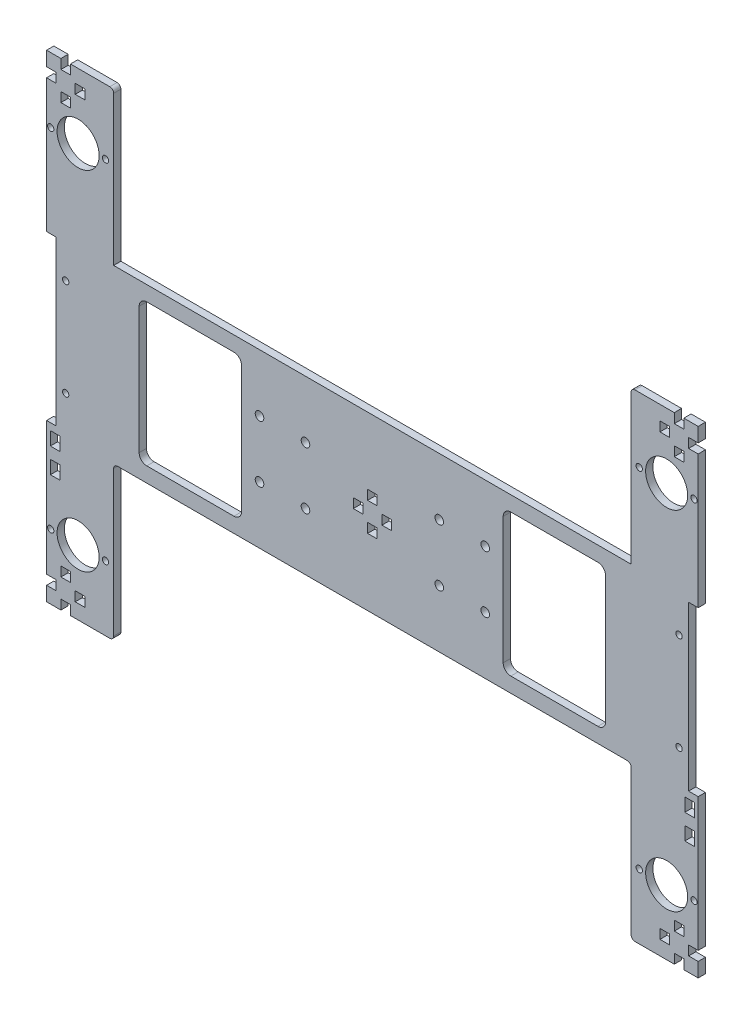
from build123d import *

# Parameters (mm, degrees)
SKETCH2_R           = 1.65
SKETCH2_R_2         = 11
SKETCH2_R_3         = 2.25
SKETCH2_W           = 5
SKETCH2_H           = 5
SKETCH2_H_2         = 7
BOSS_EXTRUDE1_DEPTH = 3.8


with BuildPart() as part:
    # Sketch2 → Boss-Extrude1 (new body)
    with BuildSketch(Plane.XY):
        with BuildLine():
            Line((-170.5, -100), (-163, -100))
            Line((-163, -100), (-163, -95))
            Line((-163, -95), (-158, -95))
            Line((-158, -95), (-158, -100))
            Line((-158, -100), (-137.4, -100))
            ThreePointArc((-137.4, -100), (-135.985786438, -99.414213562), (-135.4, -98))
            Line((-135.4, -98), (-135.4, -22))
            ThreePointArc((-135.4, -22), (-134.814213562, -20.585786438), (-133.4, -20))
            Line((-133.4, -20), (133.4, -20))
            ThreePointArc((133.4, -20), (134.814213562, -20.585786438), (135.4, -22))
            Line((135.4, -22), (135.4, -98))
            ThreePointArc((135.4, -98), (135.985786438, -99.414213562), (137.4, -100))
            Line((137.4, -100), (158, -100))
            Line((158, -100), (158, -95))
            Line((158, -95), (163, -95))
            Line((163, -95), (163, -100))
            Line((163, -100), (170.5, -100))
            Line((170.5, -100), (170.5, -92.5))
            Line((170.5, -92.5), (165.5, -92.5))
            Line((165.5, -92.5), (165.5, -87.5))
            Line((165.5, -87.5), (170.5, -87.5))
            Line((170.5, -87.5), (170.5, -17.8042249))
            Line((170.5, -17.8042249), (165.5, -17.8042249))
            Line((165.5, -17.8042249), (165.5, 67.8042249))
            Line((165.5, 67.8042249), (170.5, 67.8042249))
            Line((170.5, 67.8042249), (170.5, 137.5))
            Line((170.5, 137.5), (165.5, 137.5))
            Line((165.5, 137.5), (165.5, 142.5))
            Line((165.5, 142.5), (170.5, 142.5))
            Line((170.5, 142.5), (170.5, 150))
            Line((170.5, 150), (163, 150))
            Line((163, 150), (163, 145))
            Line((163, 145), (158, 145))
            Line((158, 145), (158, 150))
            Line((158, 150), (137.4, 150))
            ThreePointArc((137.4, 150), (135.985786438, 149.414213562), (135.4, 148))
            Line((135.4, 148), (135.4, 70))
            Line((135.4, 70), (-135.4, 70))
            Line((-135.4, 70), (-135.4, 148))
            ThreePointArc((-135.4, 148), (-135.985786438, 149.414213562), (-137.4, 150))
            Line((-137.4, 150), (-158, 150))
            Line((-158, 150), (-158, 145))
            Line((-158, 145), (-163, 145))
            Line((-163, 145), (-163, 150))
            Line((-163, 150), (-170.5, 150))
            Line((-170.5, 150), (-170.5, 142.5))
            Line((-170.5, 142.5), (-165.5, 142.5))
            Line((-165.5, 142.5), (-165.5, 137.5))
            Line((-165.5, 137.5), (-170.5, 137.5))
            Line((-170.5, 137.5), (-170.5, 67.8042249))
            Line((-170.5, 67.8042249), (-165.5, 67.8042249))
            Line((-165.5, 67.8042249), (-165.5, -17.8042249))
            Line((-165.5, -17.8042249), (-170.5, -17.8042249))
            Line((-170.5, -17.8042249), (-170.5, -87.5))
            Line((-170.5, -87.5), (-165.5, -87.5))
            Line((-165.5, -87.5), (-165.5, -92.5))
            Line((-165.5, -92.5), (-170.5, -92.5))
            Line((-170.5, -92.5), (-170.5, -100))
        make_face()
        with Locations(Location((-168.334802826, 116, 0), (0, 0, 180))):
            Circle(SKETCH2_R, mode=Mode.SUBTRACT)
        with Locations(Location((-139.665197174, 116, 0), (0, 0, 180))):
            Circle(SKETCH2_R, mode=Mode.SUBTRACT)
        with Locations(Location((168.334802826, 116, 0), (0, 0, 180))):
            Circle(SKETCH2_R, mode=Mode.SUBTRACT)
        with Locations(Location((139.665197174, 116, 0), (0, 0, 180))):
            Circle(SKETCH2_R, mode=Mode.SUBTRACT)
        with Locations(Location((154, 116, 0), (0, 0, 180))):
            Circle(SKETCH2_R_2, mode=Mode.SUBTRACT)
        with Locations(Location((-154, 116, 0), (0, 0, 180))):
            Circle(SKETCH2_R_2, mode=Mode.SUBTRACT)
        with Locations(Location((160.5, -0.5, 0), (0, 0, 180))):
            Circle(SKETCH2_R, mode=Mode.SUBTRACT)
        with Locations(Location((160.5, 50.5, 0), (0, 0, 180))):
            Circle(SKETCH2_R, mode=Mode.SUBTRACT)
        with Locations(Location((-160.5, -0.5, 0), (0, 0, 180))):
            Circle(SKETCH2_R, mode=Mode.SUBTRACT)
        with Locations(Location((-160.5, 50.5, 0), (0, 0, 180))):
            Circle(SKETCH2_R, mode=Mode.SUBTRACT)
        with Locations(Location((-35, 10.055, 0), (0, 0, 180))):
            Circle(SKETCH2_R_3, mode=Mode.SUBTRACT)
        with Locations(Location((-35, 39.945, 0), (0, 0, 180))):
            Circle(SKETCH2_R_3, mode=Mode.SUBTRACT)
        with Locations(Location((-59.06, 39.945, 0), (0, 0, 180))):
            Circle(SKETCH2_R_3, mode=Mode.SUBTRACT)
        with Locations(Location((-59.06, 10.055, 0), (0, 0, 180))):
            Circle(SKETCH2_R_3, mode=Mode.SUBTRACT)
        with Locations(Location((59.06, 10.055, 0), (0, 0, 180))):
            Circle(SKETCH2_R_3, mode=Mode.SUBTRACT)
        with Locations(Location((35, 10.055, 0), (0, 0, 180))):
            Circle(SKETCH2_R_3, mode=Mode.SUBTRACT)
        with Locations(Location((35, 39.945, 0), (0, 0, 180))):
            Circle(SKETCH2_R_3, mode=Mode.SUBTRACT)
        with Locations(Location((59.06, 39.945, 0), (0, 0, 180))):
            Circle(SKETCH2_R_3, mode=Mode.SUBTRACT)
        with Locations(Location((168.334802826, -66, 0), (0, 0, 180))):
            Circle(SKETCH2_R, mode=Mode.SUBTRACT)
        with Locations(Location((139.665197174, -66, 0), (0, 0, 180))):
            Circle(SKETCH2_R, mode=Mode.SUBTRACT)
        with Locations(Location((154, -66, 0), (0, 0, 180))):
            Circle(SKETCH2_R_2, mode=Mode.SUBTRACT)
        with Locations(Location((-154, -66, 0), (0, 0, 180))):
            Circle(SKETCH2_R_2, mode=Mode.SUBTRACT)
        with Locations(Location((-139.665197174, -66, 0), (0, 0, 180))):
            Circle(SKETCH2_R, mode=Mode.SUBTRACT)
        with Locations(Location((-168.334802826, -66, 0), (0, 0, 180))):
            Circle(SKETCH2_R, mode=Mode.SUBTRACT)
        with BuildLine():
            Line((-72.45742566, 62.171403079), (-118.05517368, 62.171403079))
            ThreePointArc((-118.05517368, 62.171403079), (-120.883600805, 60.999830204), (-122.05517368, 58.171403079))
            Line((-122.05517368, 58.171403079), (-122.05517368, -8.171403079))
            ThreePointArc((-122.05517368, -8.171403079), (-120.883600805, -10.999830204), (-118.05517368, -12.171403079))
            Line((-118.05517368, -12.171403079), (-72.45742566, -12.171403079))
            ThreePointArc((-72.45742566, -12.171403079), (-69.628998535, -10.999830204), (-68.45742566, -8.171403079))
            Line((-68.45742566, -8.171403079), (-68.45742566, 58.171403079))
            ThreePointArc((-68.45742566, 58.171403079), (-69.628998535, 60.999830204), (-72.45742566, 62.171403079))
        make_face(mode=Mode.SUBTRACT)
        with BuildLine():
            Line((72.45742566, 62.171403079), (118.05517368, 62.171403079))
            ThreePointArc((118.05517368, 62.171403079), (120.883600805, 60.999830204), (122.05517368, 58.171403079))
            Line((122.05517368, 58.171403079), (122.05517368, -8.171403079))
            ThreePointArc((122.05517368, -8.171403079), (120.883600805, -10.999830204), (118.05517368, -12.171403079))
            Line((118.05517368, -12.171403079), (72.45742566, -12.171403079))
            ThreePointArc((72.45742566, -12.171403079), (69.628998535, -10.999830204), (68.45742566, -8.171403079))
            Line((68.45742566, -8.171403079), (68.45742566, 58.171403079))
            ThreePointArc((68.45742566, 58.171403079), (69.628998535, 60.999830204), (72.45742566, 62.171403079))
        make_face(mode=Mode.SUBTRACT)
        with Locations((0, 17.5)):
            Rectangle(SKETCH2_W, SKETCH2_H, mode=Mode.SUBTRACT)
        with Locations((-7.5, 25)):
            Rectangle(SKETCH2_W, SKETCH2_H, mode=Mode.SUBTRACT)
        with Locations((0, 32.5)):
            Rectangle(SKETCH2_W, SKETCH2_H, mode=Mode.SUBTRACT)
        with Locations((7.5, 25)):
            Rectangle(SKETCH2_W, SKETCH2_H, mode=Mode.SUBTRACT)
        with Locations((153, -90)):
            Rectangle(SKETCH2_W, SKETCH2_H, mode=Mode.SUBTRACT)
        with Locations((160.5, -82.5)):
            Rectangle(SKETCH2_W, SKETCH2_H, mode=Mode.SUBTRACT)
        with Locations((-153, -90)):
            Rectangle(SKETCH2_W, SKETCH2_H, mode=Mode.SUBTRACT)
        with Locations((-160.5, -82.5)):
            Rectangle(SKETCH2_W, SKETCH2_H, mode=Mode.SUBTRACT)
        with Locations((160.5, 132.5)):
            Rectangle(SKETCH2_W, SKETCH2_H, mode=Mode.SUBTRACT)
        with Locations((153, 140)):
            Rectangle(SKETCH2_W, SKETCH2_H, mode=Mode.SUBTRACT)
        with Locations((-160.5, 132.5)):
            Rectangle(SKETCH2_W, SKETCH2_H, mode=Mode.SUBTRACT)
        with Locations((-153, 140)):
            Rectangle(SKETCH2_W, SKETCH2_H, mode=Mode.SUBTRACT)
        with Locations((-166, -24.9)):
            Rectangle(SKETCH2_W, SKETCH2_H_2, mode=Mode.SUBTRACT)
        with Locations((-166, -37.9)):
            Rectangle(SKETCH2_W, SKETCH2_H_2, mode=Mode.SUBTRACT)
        with Locations((166, -24.9)):
            Rectangle(SKETCH2_W, SKETCH2_H_2, mode=Mode.SUBTRACT)
        with Locations((166, -37.9)):
            Rectangle(SKETCH2_W, SKETCH2_H_2, mode=Mode.SUBTRACT)
    extrude(amount=BOSS_EXTRUDE1_DEPTH)


solid = part.part
